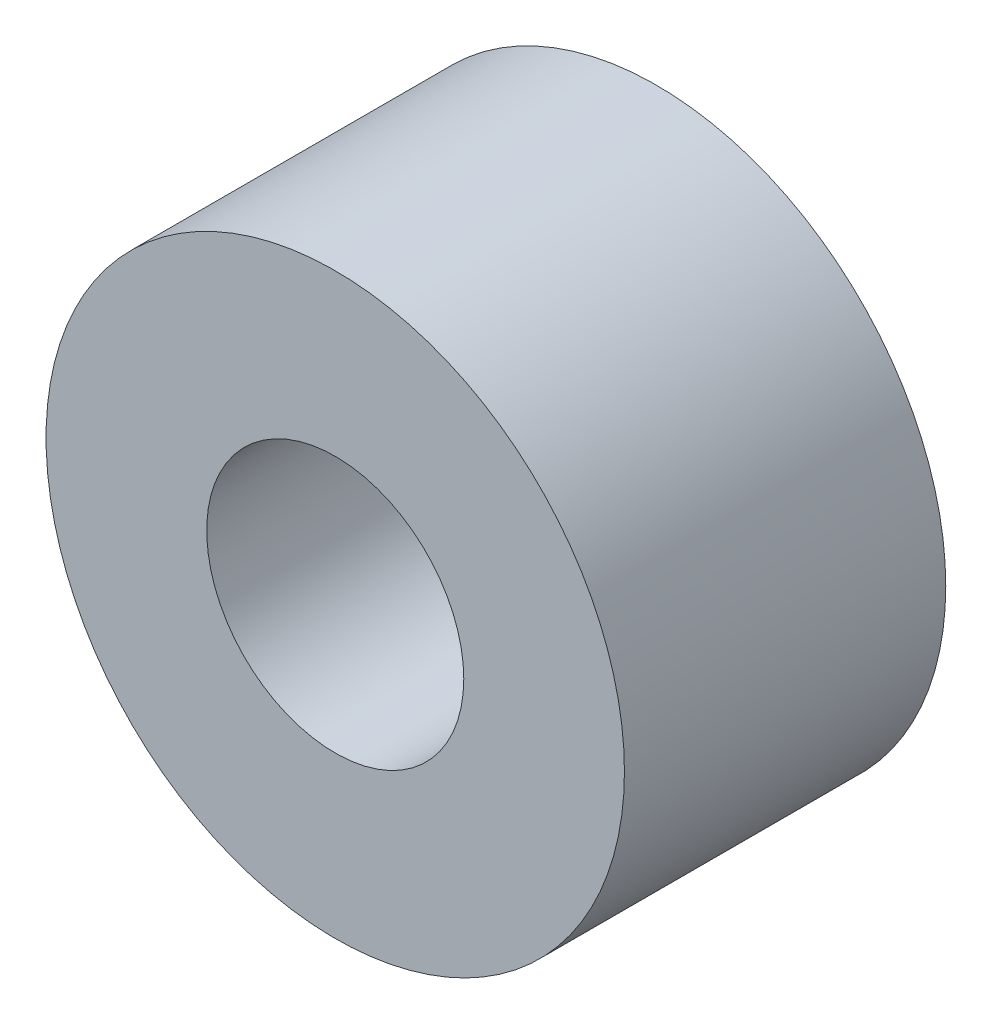
from build123d import *

# Parameters (mm, degrees)
SCHIZZO1_R                   = 9
SCHIZZO1_R_2                 = 4
ESTRUSIONE_ESTRUSIONE1_DEPTH = 10


with BuildPart() as part:
    # Schizzo1 → Estrusione-Estrusione1 (new body)
    with BuildSketch(Plane.XY):
        Circle(SCHIZZO1_R)
        Circle(SCHIZZO1_R_2, mode=Mode.SUBTRACT)
    extrude(amount=ESTRUSIONE_ESTRUSIONE1_DEPTH)


solid = part.part
